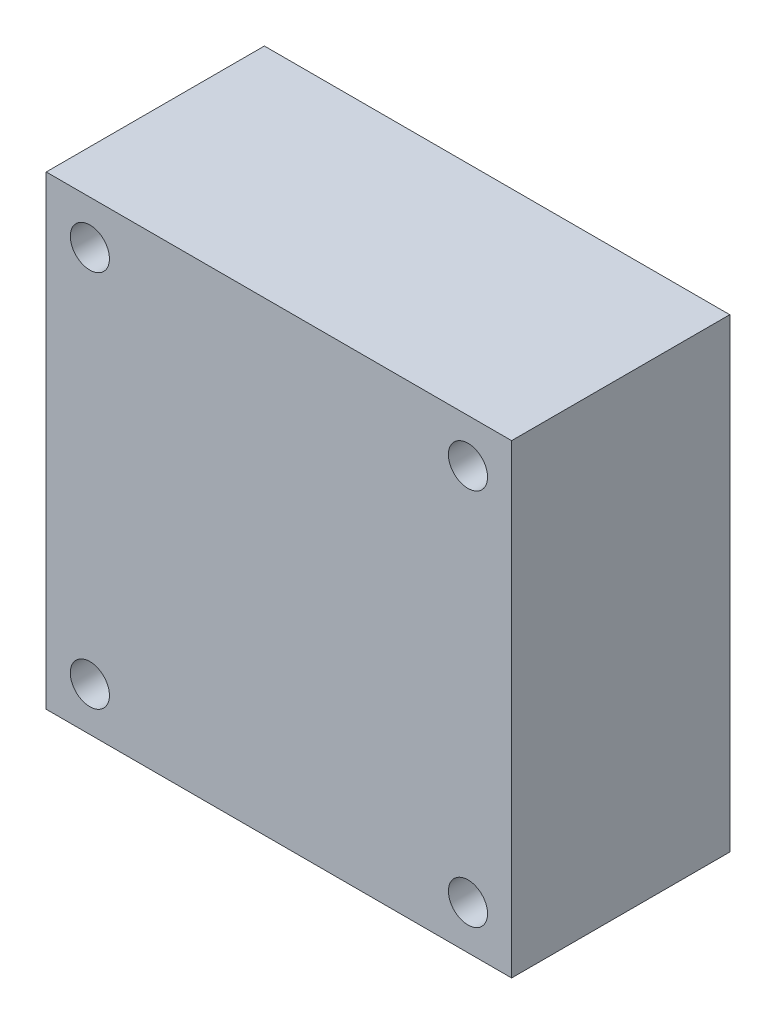
from build123d import *

# Parameters (mm, degrees)
SKETCH1_W           = 32
SKETCH1_H           = 32
SKETCH1_R           = 1.345549738
BOSS_EXTRUDE1_DEPTH = 15


with BuildPart() as part:
    # Sketch1 → Boss-Extrude1 (new body)
    with BuildSketch(Plane.XY):
        Rectangle(SKETCH1_W, SKETCH1_H)
        with Locations((-13, -13)):
            Circle(SKETCH1_R, mode=Mode.SUBTRACT)
        with Locations(Location((13, -13, 0), (0, 0, 180))):
            Circle(SKETCH1_R, mode=Mode.SUBTRACT)
        with Locations((13, 13)):
            Circle(SKETCH1_R, mode=Mode.SUBTRACT)
        with Locations(Location((-13, 13, 0), (0, 0, 180))):
            Circle(SKETCH1_R, mode=Mode.SUBTRACT)
    extrude(amount=BOSS_EXTRUDE1_DEPTH)


solid = part.part
